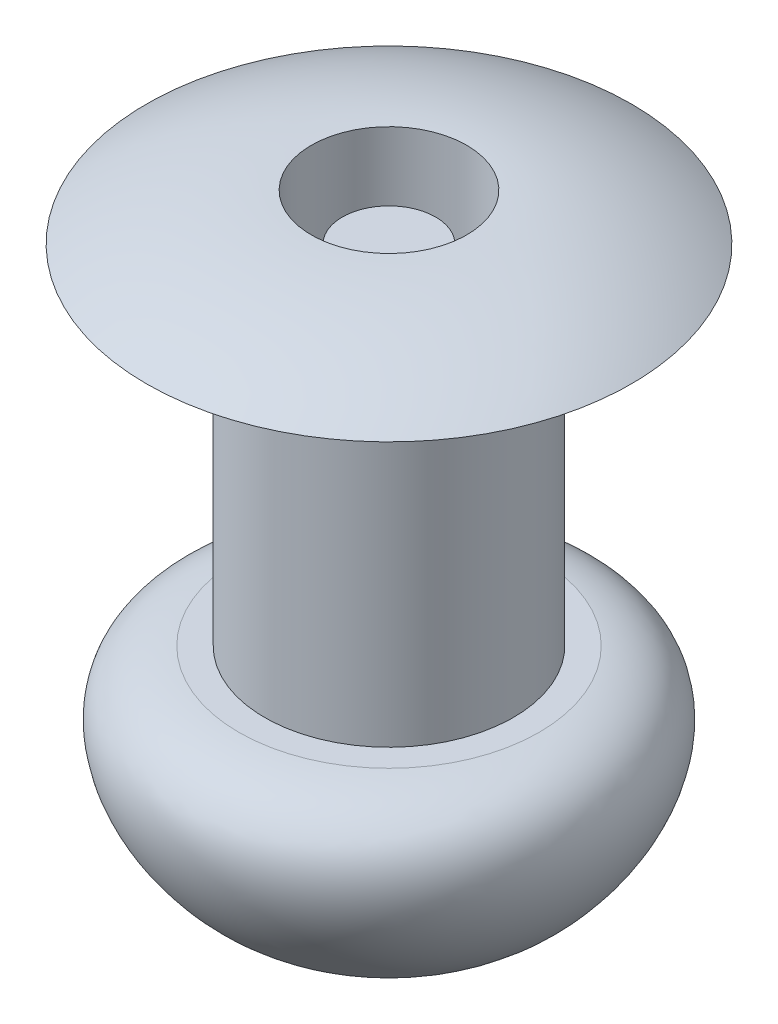
from build123d import *


with BuildPart() as part:
    # Szkic1 → Obrót1 (revolve)
    with BuildSketch(Plane(origin=(0, 0, 0), x_dir=(0, 0, -1), z_dir=(1, 0, 0)), mode=Mode.PRIVATE) as obr_t1_sk:
        with BuildLine():
            Line((0, 0), (0, -4.121746268))
            Line((0, -4.121746268), (0, -5.79843593))
            Line((0, -5.79843593), (0, -7.29843593))
            add(Edge.make_bspline(
                [(-0.956030427, -7.176626601), (-0.520263876, -7.29843593), (0, -7.29843593)],
                knots=[0.992852221, 0.992852221, 0.992852221, 1.570796327, 1.570796327, 1.570796327], degree=2, weights=[1, 0.958537313, 1]))
            add(Edge.make_bspline(
                [(-2.413891755, -5.597697407), (-3.867503112, -5.767354729), (-3.528877649, -7.899711034), (-1.083961642, -9.471229776), (-0.271752618, -7.472646705), (-0.956030427, -7.176626601)],
                knots=[0, 0, 0, 0, 0.464993082, 0.721927553, 1, 1, 1, 1], degree=3))
            Line((-2.413891755, -5.597697407), (-2, -5.597697407))
            Line((-2, -5.597697407), (-2, 0))
            Line((-2, 0), (-3.9, 0))
            ThreePointArc((-3.9, 0), (-2.627043935, 0.558888572), (-1.25, 0.75))
            Line((-1.25, 0.75), (-1.25, -5.79843593))
            Line((-1.25, -5.79843593), (-0.75, -5.79843593))
            Line((-0.75, -5.79843593), (-0.75, 0))
            Line((-0.75, 0), (0, 0))
        make_face()
    revolve(obr_t1_sk.sketch.rotate(Axis((0, 0, 0), (0, 1, 0)), 180), axis=Axis((0, 0, 0), (0, 1, 0)))


solid = part.part
